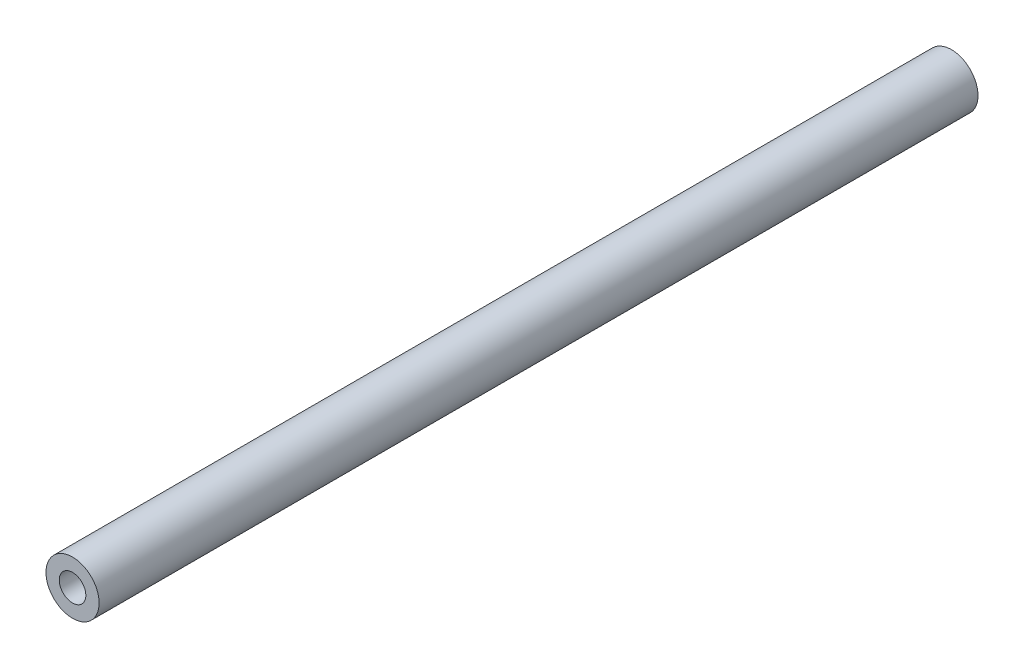
from build123d import *

# Parameters (mm, degrees)
SKETCH2_W               = 7620
SKETCH2_H               = 3.175
CUT_EXTRUDE1_DEPTH      = 3811.010583319
CUT_EXTRUDE1_DEPTH_BACK = 3811.010583319
SKETCH3_W               = 1124.286546302
SKETCH3_H               = 7825.819750898


with BuildPart() as part:
    # Sketch2 → Revolve1 (revolve)
    with BuildSketch(Plane(origin=(0, 0, 0), x_dir=(0, 0, -1), z_dir=(1, 0, 0)), mode=Mode.PRIVATE) as revolve1_sk:
        with Locations((0, 4.7625)):
            Rectangle(SKETCH2_W, SKETCH2_H)
    revolve(revolve1_sk.sketch.rotate(Axis((0, 0, 3810), (0, 0, -1)), 180), axis=Axis((0, 0, 3810), (0, 0, -1)))

    # Sketch3 → Cut-Extrude1 (cut, two sides: drawn at the far end of the back side and taken through both)
    with BuildSketch(Plane(origin=(0, 0, 0), x_dir=(1, 0, 0), z_dir=(0, 1, 0)).offset(-CUT_EXTRUDE1_DEPTH_BACK)):
        with Locations((-69.035138808, 313.026835869)):
            Rectangle(SKETCH3_W, SKETCH3_H)
    extrude(amount=CUT_EXTRUDE1_DEPTH + CUT_EXTRUDE1_DEPTH_BACK, mode=Mode.SUBTRACT)


solid = part.part
